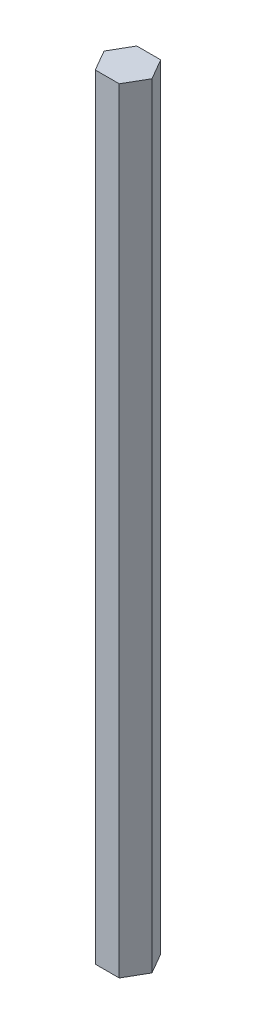
from build123d import *

# Parameters (mm, degrees)
BOSS_EXTRUDE1_DEPTH = 97
SKETCH3_R           = 1.6
CUT_EXTRUDE1_DEPTH  = 5


with BuildPart() as part:
    # Sketch1 → Boss-Extrude1 (new body)
    with BuildSketch(Plane(origin=(0, 0, 0), x_dir=(1, 0, 0), z_dir=(0, 1, 0))):
        Polygon((3, 0), (1.5, 2.598076211), (-1.5, 2.598076211), (-3, 0), (-1.5, -2.598076211), (1.5, -2.598076211), align=None)
    extrude(amount=BOSS_EXTRUDE1_DEPTH)

    # Sketch3 → Cut-Extrude1 (cut)
    with BuildSketch(Plane.XZ):
        with Locations(Location((0, 0, 0), (0, 0, 270))):
            Circle(SKETCH3_R)
    extrude(amount=-CUT_EXTRUDE1_DEPTH, mode=Mode.SUBTRACT)


solid = part.part
